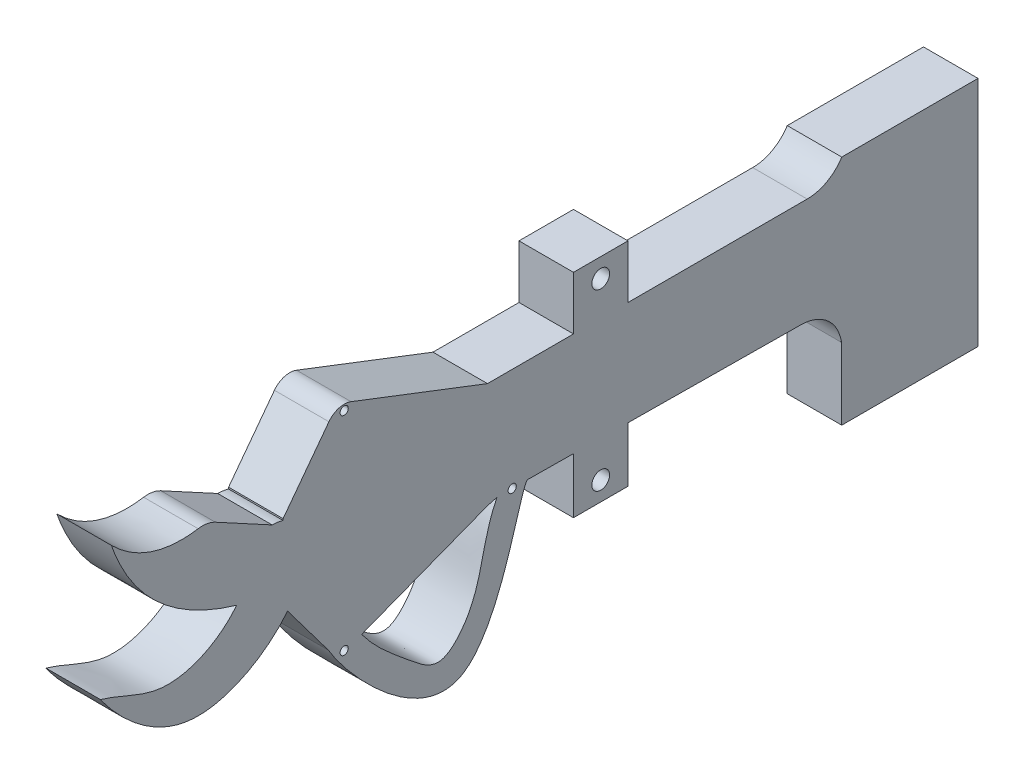
from build123d import *

# Parameters (mm, degrees)
SKETCH15_W           = 20
SKETCH15_H           = 19.589999995
SKETCH15_R           = 3.25
SKETCH15_R_2         = 1.5
BOSS_EXTRUDE15_DEPTH = 20


with BuildPart() as part:
    # Sketch15 → Boss-Extrude15 (new body)
    # profile 1 of 9: a face of its own
    with BuildSketch(Plane(origin=(70, 0, 0), x_dir=(0, 0, -1), z_dir=(1, 0, 0))):
        with Locations((-88.44000001, 29.205000003)):
            Rectangle(SKETCH15_W, SKETCH15_H)
        with Locations((-88.44000001, 32)):
            Circle(SKETCH15_R, mode=Mode.SUBTRACT)
    # profile 2 of 9: a face of its own
    with BuildSketch(Plane(origin=(70, 0, 0), x_dir=(0, 0, -1), z_dir=(1, 0, 0))):
        Polygon((-78.44000001, 19.410000005), (-98.44000001, 19.410000005), (-98.44000001, -18.619677344), (-78.44000001, -18.809112305), align=None)
    # profile 3 of 9: a face of its own
    with BuildSketch(Plane(origin=(70, 0, 0), x_dir=(0, 0, -1), z_dir=(1, 0, 0))):
        with BuildLine():
            Line((-98.44000001, -18.619677344), (-98.44000001, 19.410000005))
            Line((-98.44000001, 19.410000005), (-129.999999775, 19.410000005))
            Line((-129.999999775, 19.410000005), (-180.065314543, 38.70335176))
            ThreePointArc((-180.065314543, 38.70335176), (-182.272264238, 39.16469668), (-184.511391341, 38.900545379))
            ThreePointArc((-184.511391341, 38.900545379), (-186.550399309, 37.938302132), (-188.177753017, 36.377794049))
            Line((-188.177753017, 36.377794049), (-205, 14))
            Line((-205, 14), (-205, 13.416407865))
            ThreePointArc((-205, 13.416407865), (-197.77502784, 8.366600265), (-195, 0))
            ThreePointArc((-195, 0), (-197.77502784, -8.366600265), (-205, -13.416407865))
            Line((-205, -13.416407865), (-205, -14))
            Line((-205, -14), (-203.346653557, -16.199364106))
            Line((-203.346653557, -16.199364106), (-188.339722055, -36.162334737))
            Line((-188.339722055, -36.162334737), (-188.177753017, -36.377794049))
            ThreePointArc((-188.177753017, -36.377794049), (-186.364430041, -38.06193991), (-184.078396039, -39.009851321))
            ThreePointArc((-184.078396039, -39.009851321), (-182.582425277, -37.619721199), (-181.08645446, -39.009851262))
            ThreePointArc((-181.08645446, -39.009851262), (-180.570040891, -38.87607057), (-180.065314768, -38.703351755))
            Line((-180.065314768, -38.703351755), (-176.171363895, -37.202764687))
            Line((-176.171363895, -37.202764687), (-130, -19.41))
            Line((-130, -19.41), (-126.491444941, -18.459363472))
            Line((-126.491444941, -18.459363472), (-122.428461685, -18.459363472))
            ThreePointArc((-122.428461685, -18.459363472), (-120.928461684, -16.959363475), (-119.428461685, -18.459363475))
            Line((-119.428461685, -18.459363477), (-115.365478429, -18.459363477))
            Line((-115.365478429, -18.459363477), (-98.44000001, -18.619677344))
        make_face()
        with Locations((-182.582425247, 37.130278801)):
            Circle(SKETCH15_R_2, mode=Mode.SUBTRACT)
    # profile 4 of 9: a face of its own
    with BuildSketch(Plane(origin=(70, 0, 0), x_dir=(0, 0, -1), z_dir=(1, 0, 0))):
        Polygon((-78.44000001, -18.809112305), (-98.44000001, -18.619677344), (-98.44000001, -39), (-78.44000001, -39), align=None)
        with Locations((-88.44000001, -32)):
            Circle(SKETCH15_R, mode=Mode.SUBTRACT)
    # profile 5 of 9: a face of its own
    with BuildSketch(Plane(origin=(70, 0, 0), x_dir=(0, 0, -1), z_dir=(1, 0, 0))):
        with BuildLine():
            Line((-12.688577312, 19.410000005), (-78.44000001, 19.410000005))
            Line((-78.44000001, 19.410000005), (-78.44000001, -18.809112305))
            Line((-78.44000001, -18.809112305), (-15, -19.41))
            add(Edge.make_bspline(
                [(-15, -19.41), (-13.249547591, -19.408181615), (-10.636542877, -19.873423975), (-7.227483858, -21.463217214), (-4.430660235, -23.529969815), (-1.938135904, -26.620123221), (-0.647154722, -29.848037608), (-0.151937094, -31.836563519), (-1e-08, -32.543888031)],
                knots=[0, 0, 0, 0, 0.092790772, 0.138362295, 0.198534542, 0.275880543, 0.345017918, 0.382436923, 0.382436923, 0.382436923, 0.382436923], degree=3))
            Line((-1e-08, -32.543888031), (-1e-08, -58.810000307))
            Line((-1e-08, -58.810000307), (49.99999999, -58.810000307))
            Line((49.99999999, -58.810000307), (49.99999999, 26.409999693))
            Line((49.99999999, 26.409999693), (-2.31e-07, 26.409999693))
            add(Edge.make_bspline(
                [(-12.688577312, 19.410000005), (-7.650038915, 19.35149242), (-2.642112225, 22.134845248), (-2.31e-07, 26.409999693)],
                knots=[0, 0, 0, 0, 1, 1, 1, 1], degree=3))
        make_face()
    # profile 6 of 9: a face of its own
    with BuildSketch(Plane(origin=(70, 0, 0), x_dir=(0, 0, -1), z_dir=(1, 0, 0))):
        with BuildLine():
            add(Edge.make_bspline(
                [(-115.365478429, -18.459363477), (-118.337689795, -20.667625344), (-132.142409229, -105.183313139), (-182.50008697, -46.527893183), (-188.339722067, -36.162334746)],
                knots=[0.032689724, 0.032689724, 0.032689724, 0.032689724, 0.488322638, 0.982304333, 0.982304333, 0.982304333, 0.982304333], degree=3))
            Line((-115.365478429, -18.459363477), (-119.428461685, -18.459363477))
            ThreePointArc((-119.428461685, -18.459363475), (-120.928461687, -19.959363475), (-122.428461685, -18.459363472))
            Line((-122.428461685, -18.459363472), (-126.491444941, -18.459363472))
            add(Edge.make_bspline(
                [(-176.171363894, -37.20276469), (-171.139612123, -44.049971955), (-162.799958037, -50.611377733), (-148.082213467, -63.100400251), (-130.811998287, -46.574461422), (-132.676351157, -30.352203006), (-126.491444941, -18.459363472)],
                knots=[0.060690419, 0.060690419, 0.060690419, 0.060690419, 0.334246994, 0.47319649, 0.580462847, 0.999065803, 0.999065803, 0.999065803, 0.999065803], degree=3))
            Line((-176.171363895, -37.202764687), (-180.065314768, -38.703351755))
            ThreePointArc((-180.065314768, -38.703351755), (-180.570040891, -38.87607057), (-181.08645446, -39.009851262))
            ThreePointArc((-181.08645446, -39.009851262), (-181.083432889, -39.064749303), (-181.082425247, -39.119721199))
            ThreePointArc((-181.082425247, -39.119721199), (-182.637397114, -40.618713559), (-184.078396039, -39.009851321))
            ThreePointArc((-184.078396039, -39.009851321), (-186.364430041, -38.06193991), (-188.177753017, -36.377794049))
            Line((-188.177753017, -36.377794049), (-188.339722055, -36.162334737))
        make_face()
    # profile 7 of 9: a face of its own
    with BuildSketch(Plane(origin=(70, 0, 0), x_dir=(0, 0, -1), z_dir=(1, 0, 0))):
        with BuildLine():
            add(Edge.make_bspline(
                [(-203.346653557, -16.199364106), (-211.226597536, -26.08083046), (-240.341367609, -42.642056022), (-264.544843043, -20.588986196), (-272, -10)],
                knots=[0, 0, 0, 0, 0.497870866, 1, 1, 1, 1], degree=3))
            Line((-203.346653557, -16.199364106), (-205, -14))
            Line((-205, -14), (-205, -13.416407865))
            ThreePointArc((-205, -13.416407865), (-215.189150723, -12.557643621), (-222.076696831, -5))
            add(Edge.make_bspline(
                [(-272, -10), (-264.545129876, -12.082948955), (-248.030952015, -22.766414555), (-228.235082791, -13.000064926), (-222.076696831, -5)],
                knots=[0, 0, 0, 0, 0.427590857, 1, 1, 1, 1], degree=3))
        make_face()
    # profile 8 of 9: a face of its own
    with BuildSketch(Plane(origin=(70, 0, 0), x_dir=(0, 0, -1), z_dir=(1, 0, 0))):
        with BuildLine():
            ThreePointArc((-222.076696831, -5), (-215.189150723, -12.557643621), (-205, -13.416407865))
            ThreePointArc((-205, -13.416407865), (-197.77502784, -8.366600265), (-195, 0))
            ThreePointArc((-195, 0), (-197.77502784, 8.366600265), (-205, 13.416407865))
            ThreePointArc((-205, 13.416407865), (-206.97882585, 13.853333716), (-209, 14))
            ThreePointArc((-209, 14), (-220.532562595, 7.937253933), (-222.076696831, -5))
        make_face()
    # profile 9 of 9: a face of its own
    with BuildSketch(Plane(origin=(70, 0, 0), x_dir=(0, 0, -1), z_dir=(1, 0, 0))):
        with BuildLine():
            add(Edge.make_bspline(
                [(-222.076696831, -5), (-257.061665042, 5.267819927), (-268, 37)],
                knots=[0, 0, 0, 1, 1, 1], degree=2))
            ThreePointArc((-222.076696831, -5), (-220.532562595, 7.937253933), (-209, 14))
            Line((-209, 14), (-229.860874802, 25.299640518))
            ThreePointArc((-229.860874802, 25.299640518), (-232.927225248, 26.361767888), (-236.172225659, 26.386097743))
            add(Edge.make_bspline(
                [(-268, 37), (-259.138798147, 28.095153636), (-248.271123635, 24.489684832), (-236.172225659, 26.386097743)],
                knots=[0, 0, 0, 0, 0.92040658, 0.92040658, 0.92040658, 0.92040658], degree=3))
        make_face()
    extrude(amount=BOSS_EXTRUDE15_DEPTH)


solid = part.part
